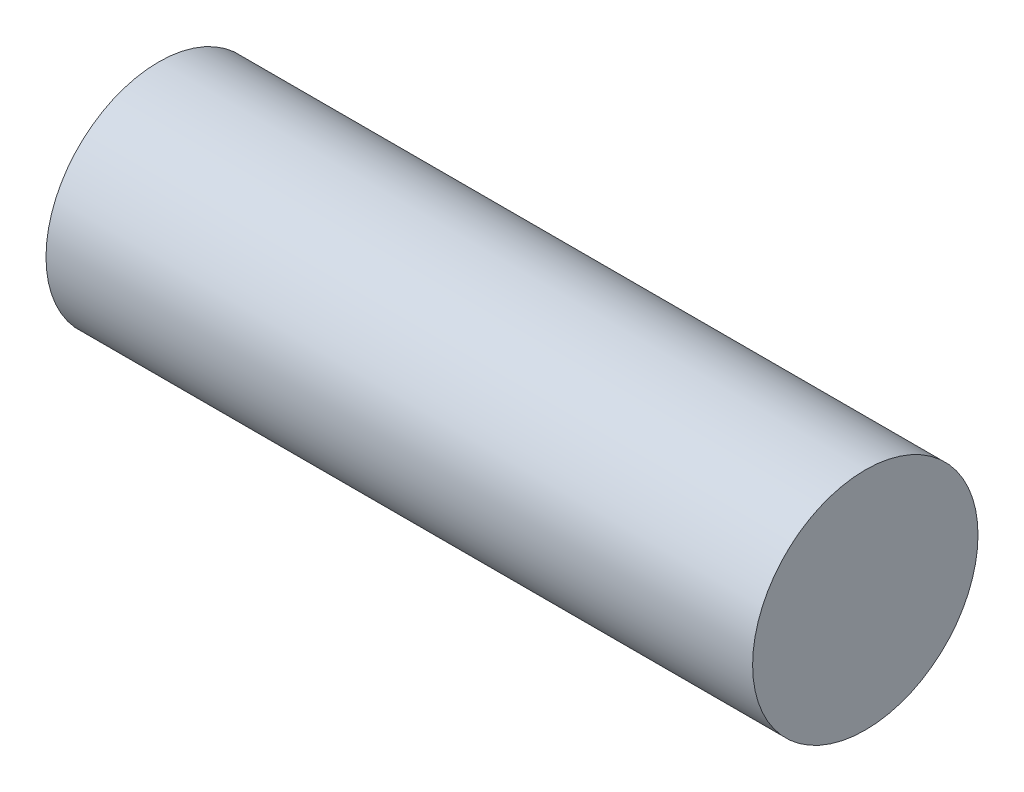
from build123d import *

# Parameters (mm, degrees)
SKETCH1_R           = 9.25
BOSS_EXTRUDE1_DEPTH = 58
SKETCH2_R           = 2.5
BOSS_EXTRUDE2_DEPTH = 1


with BuildPart() as part:
    # Sketch1 → Boss-Extrude1 (new body)
    with BuildSketch(Plane(origin=(0, 0, 0), x_dir=(0, 0, -1), z_dir=(1, 0, 0))):
        with Locations(Location((0, 0, 0), (0, 0, 180))):
            Circle(SKETCH1_R)
    extrude(amount=BOSS_EXTRUDE1_DEPTH)

    # Sketch2 → Boss-Extrude2 (add)
    with BuildSketch(Plane.ZY):
        with Locations(Location((0, 4, 0), (0, 0, 180))):
            Circle(SKETCH2_R)
        with Locations(Location((0, -4, 0), (0, 0, 180))):
            Circle(SKETCH2_R)
    extrude(amount=BOSS_EXTRUDE2_DEPTH)


solid = part.part
